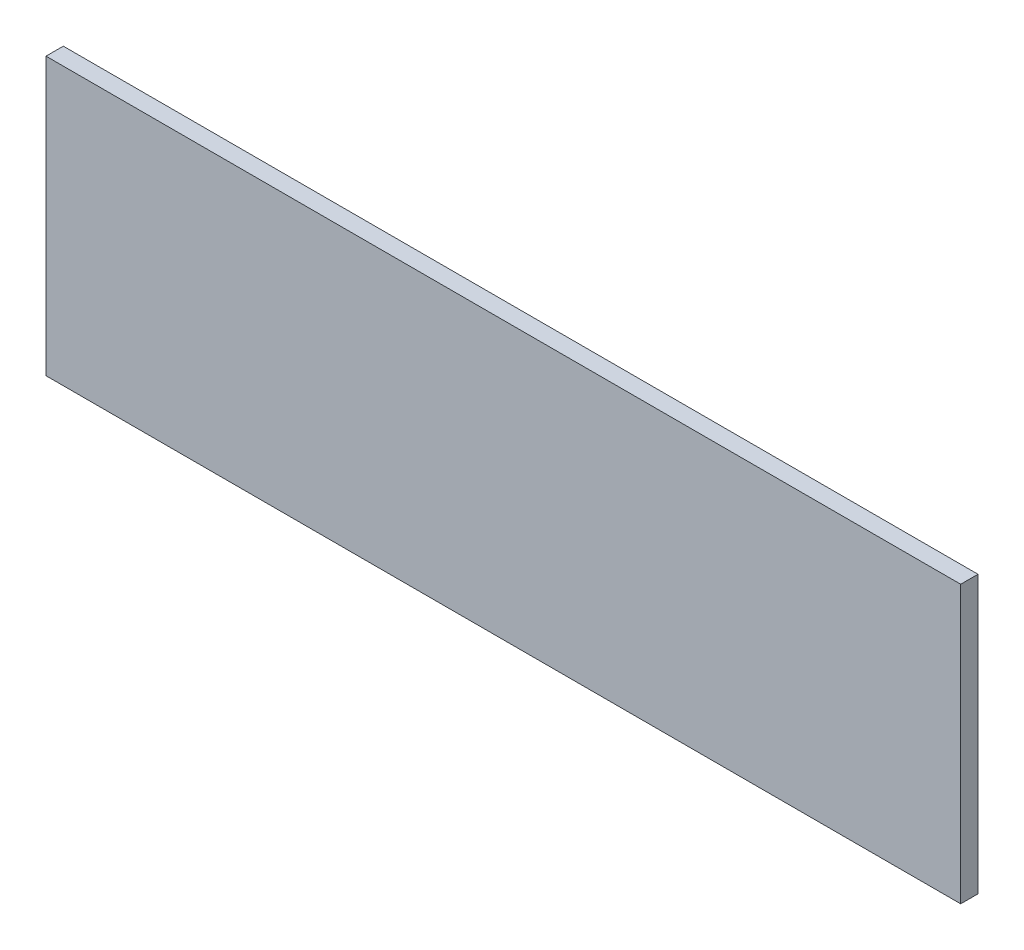
from build123d import *

# Parameters (mm, degrees)
SKETCH1_W           = 671.5125
SKETCH1_H           = 203.2
BOSS_EXTRUDE1_DEPTH = 12.7


with BuildPart() as part:
    # Sketch1 → Boss-Extrude1 (new body)
    with BuildSketch(Plane.XY):
        with Locations((0, -196.85)):
            Rectangle(SKETCH1_W, SKETCH1_H)
    extrude(amount=BOSS_EXTRUDE1_DEPTH)


solid = part.part
